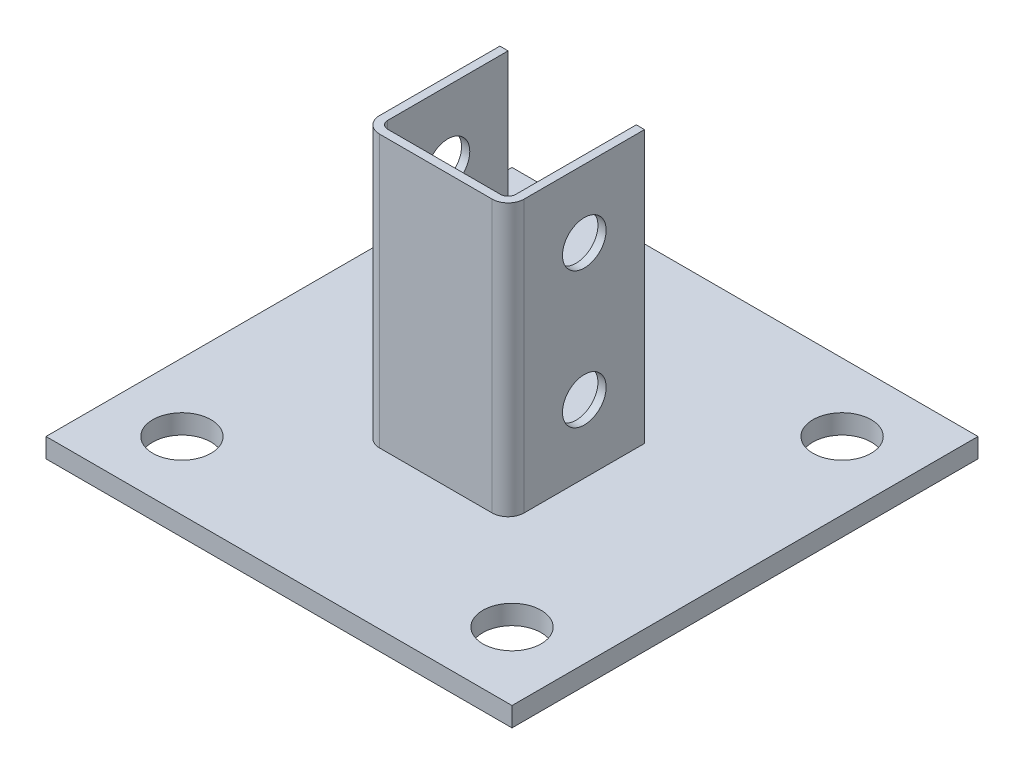
from build123d import *

# Parameters (mm, degrees)
SKETCH1_W                          = 152.4
SKETCH1_H                          = 152.4
EXTRUDE1_DEPTH                     = 6.35
F_3_4_0_75_DIAMETER_HOLE1_D        = 19.05
F_3_4_0_75_DIAMETER_HOLE1_DEPTH    = 112.776
F_3_4_0_75_DIAMETER_HOLE1_TIP      = 5.723197396
EXTRUDE_THIN1_DEPTH                = 88.9
F_9_16_0_5625_DIAMETER_HOLE1_D     = 14.2875
F_9_16_0_5625_DIAMETER_HOLE1_DEPTH = 112.776
F_9_16_0_5625_DIAMETER_HOLE1_TIP   = 4.292398047


with BuildPart() as part:
    # Sketch1 → Extrude1 (new body)
    with BuildSketch(Plane(origin=(0, 0, 0), x_dir=(1, 0, 0), z_dir=(0, 1, 0))):
        Rectangle(SKETCH1_W, SKETCH1_H)
    extrude(amount=EXTRUDE1_DEPTH)

    # 3/4 (0.75) Diameter Hole1
    with Locations(Plane(origin=(0, 6.35, 0), x_dir=(-1, 0, 0), z_dir=(0, 1, 0))):
        with Locations((53.975, -53.975), (-53.975, -53.975), (-53.975, 53.975), (53.975, 53.975)):
            Hole(F_3_4_0_75_DIAMETER_HOLE1_D / 2, depth=F_3_4_0_75_DIAMETER_HOLE1_DEPTH)
            with Locations((0, 0, -(F_3_4_0_75_DIAMETER_HOLE1_DEPTH + F_3_4_0_75_DIAMETER_HOLE1_TIP / 2))):  # 118° drill point
                Cone(0, F_3_4_0_75_DIAMETER_HOLE1_D / 2, F_3_4_0_75_DIAMETER_HOLE1_TIP, mode=Mode.SUBTRACT)

    # Sketch4 → Extrude-Thin1 (add)
    with BuildSketch(Plane(origin=(0, 6.35, 0), x_dir=(1, 0, 0), z_dir=(0, 1, 0))):
        with BuildLine():
            Line((-20.955, 19.685), (-20.955, -19.685))
            ThreePointArc((-20.955, -19.685), (-20.211051224, -21.481051224), (-18.415, -22.225))
            Line((-18.415, -22.225), (18.415, -22.225))
            ThreePointArc((18.415, -22.225), (20.211051224, -21.481051224), (20.955, -19.685))
            Line((20.955, -19.685), (20.955, 19.685))
            Line((20.955, 19.685), (23.6474, 19.685))
            Line((23.6474, 19.685), (23.6474, -19.685))
            ThreePointArc((23.6474, -19.685), (22.114865522, -23.384865522), (18.415, -24.9174))
            Line((18.415, -24.9174), (-18.415, -24.9174))
            ThreePointArc((-18.415, -24.9174), (-22.114865522, -23.384865522), (-23.6474, -19.685))
            Line((-23.6474, -19.685), (-23.6474, 19.685))
            Line((-23.6474, 19.685), (-20.955, 19.685))
        make_face()
    extrude(amount=EXTRUDE_THIN1_DEPTH)

    # 9/16 (0.5625) Diameter Hole1
    with Locations(Plane(origin=(23.6474, 0, 0), x_dir=(0, 0, -1), z_dir=(1, 0, 0))):
        with Locations((0, 73.025), (0, 28.575)):
            Hole(F_9_16_0_5625_DIAMETER_HOLE1_D / 2, depth=F_9_16_0_5625_DIAMETER_HOLE1_DEPTH)
            with Locations((0, 0, -(F_9_16_0_5625_DIAMETER_HOLE1_DEPTH + F_9_16_0_5625_DIAMETER_HOLE1_TIP / 2))):  # 118° drill point
                Cone(0, F_9_16_0_5625_DIAMETER_HOLE1_D / 2, F_9_16_0_5625_DIAMETER_HOLE1_TIP, mode=Mode.SUBTRACT)


solid = part.part
